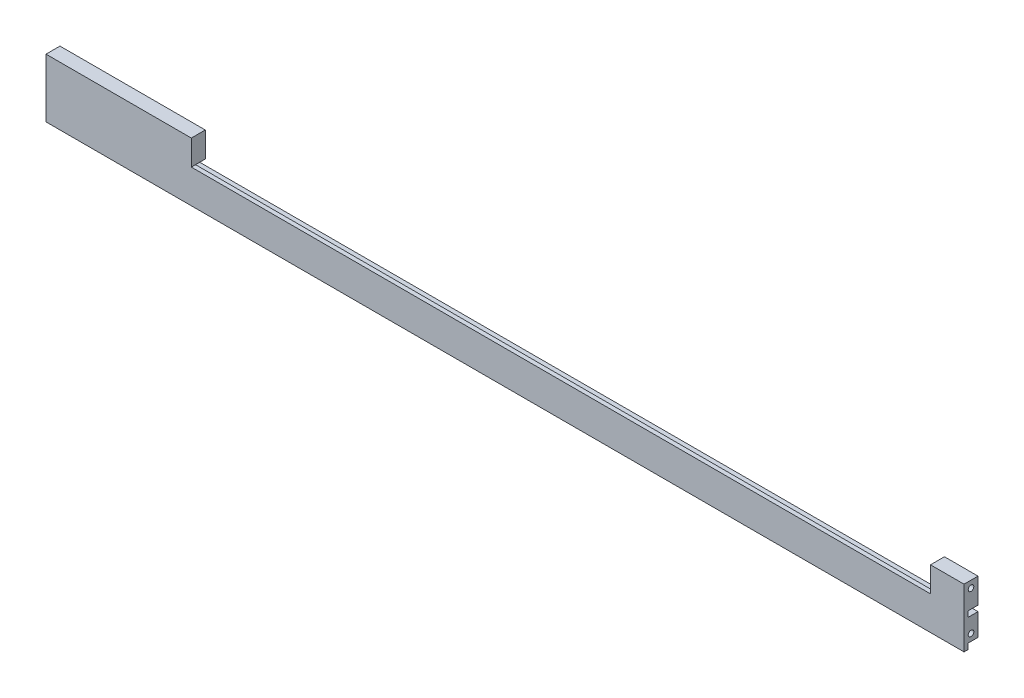
from build123d import *

# Parameters (mm, degrees)
BOSS_EXTRUDE1_DEPTH = 10
SKETCH2_W           = 657
SKETCH2_H           = 4
CUT_EXTRUDE1_DEPTH  = 7
SKETCH3_W           = 657
SKETCH3_H           = 4
CUT_EXTRUDE2_DEPTH  = 7
SKETCH4_R           = 1.5
CUT_EXTRUDE3_DEPTH  = 12
SKETCH6_R           = 2
CUT_EXTRUDE4_DEPTH  = 10
CUT_EXTRUDE5_START  = -10
SKETCH7_R           = 2
CUT_EXTRUDE5_DEPTH  = 10


with BuildPart() as part:
    # Sketch1 → Boss-Extrude1 (new body)
    with BuildSketch(Plane.XY):
        Polygon((-482.706212002, 28.610388863), (-482.706212002, -13.389611137), (174.293787998, -13.389611137), (174.293787998, 28.610388863), (150.293787998, 28.610388863), (150.293787998, 10.610388863), (-378.706212002, 10.610388863), (-378.706212002, 28.610388863), align=None)
    extrude(amount=BOSS_EXTRUDE1_DEPTH)

    # Sketch2 → Cut-Extrude1 (cut)
    with BuildSketch(Plane(origin=(0, 0, 0), x_dir=(-1, 0, 0), z_dir=(0, 0, -1))):
        with Locations((154.206212002, 8.610388863)):
            Rectangle(SKETCH2_W, SKETCH2_H)
    extrude(amount=-CUT_EXTRUDE1_DEPTH, mode=Mode.SUBTRACT)

    # Sketch3 → Cut-Extrude2 (cut)
    with BuildSketch(Plane(origin=(0, 0, 0), x_dir=(-1, 0, 0), z_dir=(0, 0, -1))):
        with Locations((154.206212002, -11.389611137)):
            Rectangle(SKETCH3_W, SKETCH3_H)
    extrude(amount=-CUT_EXTRUDE2_DEPTH, mode=Mode.SUBTRACT)

    # Sketch4 → Cut-Extrude3 (cut)
    with BuildSketch(Plane.XZ.offset(9.389611137)):
        with Locations(Location((-432.706212002, 3.5, 0), (0, 0, 270))):
            Circle(SKETCH4_R)
        with Locations(Location((-154.206212002, 3.5, 0), (0, 0, 270))):
            Circle(SKETCH4_R)
        with Locations(Location((124.293787998, 3.5, 0), (0, 0, 270))):
            Circle(SKETCH4_R)
    extrude(amount=-CUT_EXTRUDE3_DEPTH, mode=Mode.SUBTRACT)

    # Sketch6 → Cut-Extrude4 (cut)
    with BuildSketch(Plane(origin=(174.293787998, 0, 0), x_dir=(0, 0, -1), z_dir=(1, 0, 0))):
        with Locations((-5, 23.610388863)):
            Circle(SKETCH6_R)
        with Locations((-5, -4.389611137)):
            Circle(SKETCH6_R)
    extrude(amount=-CUT_EXTRUDE4_DEPTH, mode=Mode.SUBTRACT)

    # Sketch7 → Cut-Extrude5 (cut)
    with BuildSketch(Plane.ZY.offset(482.706212002).offset(CUT_EXTRUDE5_START)):
        with Locations(Location((5, 23.610388863, 0), (0, 0, 180))):
            Circle(SKETCH7_R)
        with Locations(Location((5, -4.389611137, 0), (0, 0, 180))):
            Circle(SKETCH7_R)
    extrude(amount=CUT_EXTRUDE5_DEPTH, mode=Mode.SUBTRACT)


solid = part.part
